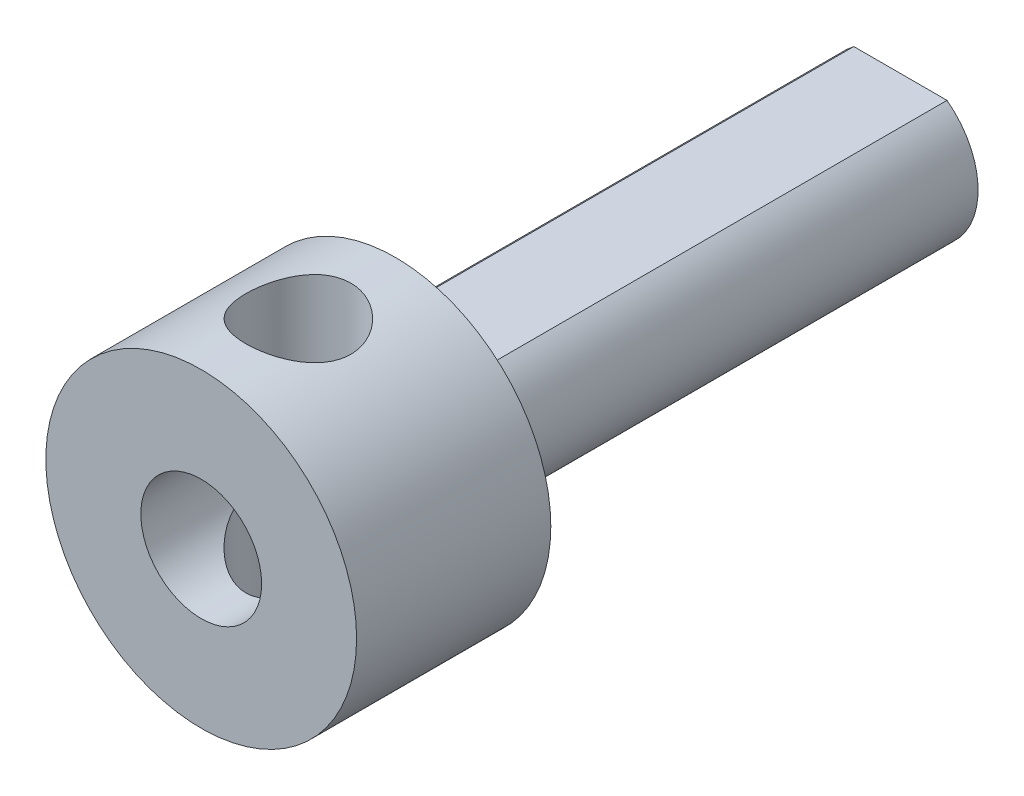
from build123d import *

# Parameters (mm, degrees)
SKETCH1_R             = 4
BOSS_EXTRUDE1_DEPTH   = 5
SKETCH2_R             = 1.555
CUT_EXTRUDE1_DEPTH    = 4
BOSS_EXTRUDE2_DEPTH   = 13
F_6_32_TAPPED_HOLE2_D = 2.7051


with BuildPart() as part:
    # Sketch1 → Boss-Extrude1 (new body)
    with BuildSketch(Plane.XY):
        Circle(SKETCH1_R)
    extrude(amount=BOSS_EXTRUDE1_DEPTH)

    # Sketch2 → Cut-Extrude1 (cut)
    with BuildSketch(Plane.XY.offset(5)):
        Circle(SKETCH2_R)
    extrude(amount=-CUT_EXTRUDE1_DEPTH, mode=Mode.SUBTRACT)

    # Sketch3 → Boss-Extrude2 (add)
    with BuildSketch(Plane(origin=(0, 0, 0), x_dir=(-1, 0, 0), z_dir=(0, 0, -1))):
        with BuildLine():
            Line((1.2, 1.6), (-1.2, 1.6))
            ThreePointArc((-1.2, 1.6), (-0.894427191, -1.788854382), (2, 0))
            ThreePointArc((2, 0), (1.788854382, 0.894427191), (1.2, 1.6))
        make_face()
    extrude(amount=BOSS_EXTRUDE2_DEPTH)

    # #6-32 Tapped Hole2 (through all)
    with Locations(Plane(origin=(0, 4, 0), x_dir=(1, 0, 0), z_dir=(0, 1, 0))):
        with Locations((0, -2.5)):
            Hole(F_6_32_TAPPED_HOLE2_D / 2)


solid = part.part
